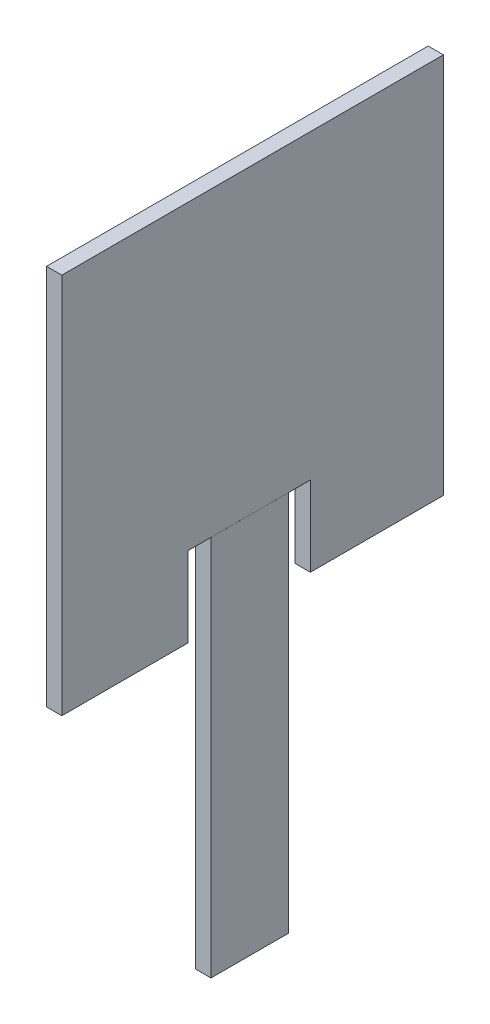
from build123d import *

# Parameters (mm, degrees)
SKETCH1_W           = 2.5
SKETCH1_H           = 2.5
BOSS_EXTRUDE1_DEPTH = 0.1
SKETCH3_W           = 0.8
SKETCH3_H           = 0.917724766
CUT_EXTRUDE3_DEPTH  = 10
SKETCH4_W           = 0.100034456
SKETCH4_H           = 0.50688293
BOSS_EXTRUDE3_DEPTH = 2.5


with BuildPart() as part:
    # Sketch1 → Boss-Extrude1 (new body)
    with BuildSketch(Plane(origin=(0, 0, 0), x_dir=(0, 0, -1), z_dir=(1, 0, 0))):
        Rectangle(SKETCH1_W, SKETCH1_H)
    extrude(amount=BOSS_EXTRUDE1_DEPTH)

    # Sketch3 → Cut-Extrude3 (cut)
    with BuildSketch(Plane(origin=(0.1, 0, 0), x_dir=(0, 0, -1), z_dir=(1, 0, 0))):
        with Locations((-0.021857305, -1.185137072)):
            Rectangle(SKETCH3_W, SKETCH3_H)
    extrude(amount=-CUT_EXTRUDE3_DEPTH, mode=Mode.SUBTRACT)

    # Sketch4 → Boss-Extrude3 (add)
    with BuildSketch(Plane(origin=(0, -0.726274689, 0), x_dir=(-1, 0, 0), z_dir=(0, -1, 0))):
        with Locations((-0.050017228, -0.019425151)):
            Rectangle(SKETCH4_W, SKETCH4_H)
    extrude(amount=BOSS_EXTRUDE3_DEPTH)


solid = part.part
